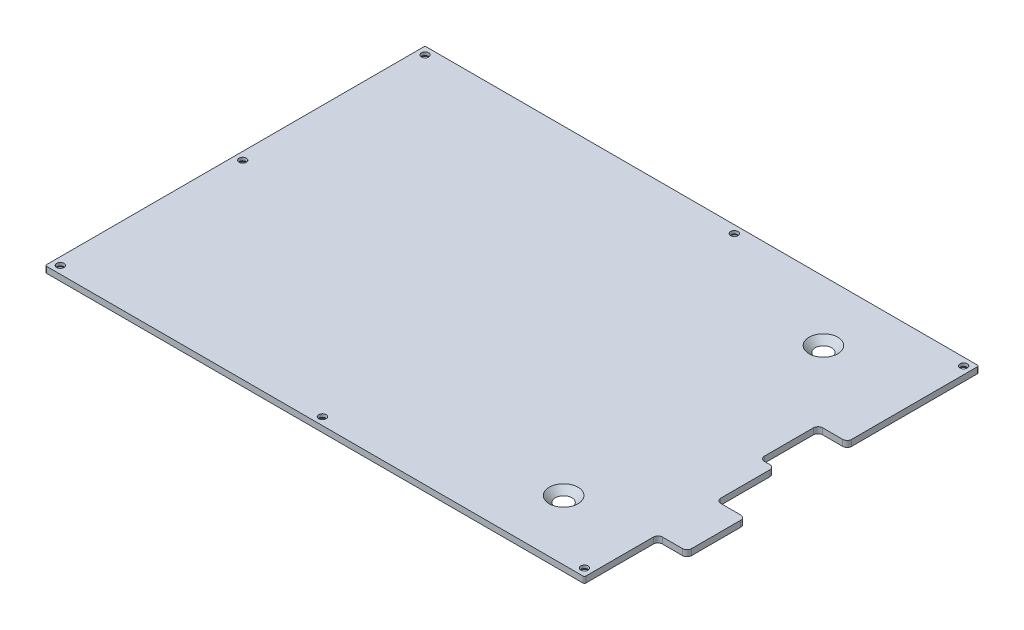
from build123d import *

# Parameters (mm, degrees)
PLATE_FRAME_DEPTH                              = 2
CSK_FOR_M2_FLAT_HEAD_MACHINE_SCREW2_AT_2_COUNT = 2
CSK_FOR_M2_FLAT_HEAD_MACHINE_SCREW2_AT_2_PITCH = 75
CSK_FOR_M2_FLAT_HEAD_MACHINE_SCREW2_AT_3_COUNT = 2
CSK_FOR_M2_FLAT_HEAD_MACHINE_SCREW2_AT_3_PITCH = 176.2125
CSK_FOR_M2_FLAT_HEAD_MACHINE_SCREW2_AT_4_COUNT = 2
CSK_FOR_M2_FLAT_HEAD_MACHINE_SCREW2_AT_4_PITCH = 186.034856025
CSK_FOR_M2_FLAT_HEAD_MACHINE_SCREW2_AT_5_COUNT = 2
CSK_FOR_M2_FLAT_HEAD_MACHINE_SCREW2_AT_5_PITCH = 212.798813804
CSK_FOR_M2_FLAT_HEAD_MACHINE_SCREW2_AT_6_COUNT = 2
CSK_FOR_M2_FLAT_HEAD_MACHINE_SCREW2_AT_6_PITCH = 149.734690891
CSK_FOR_M2_FLAT_HEAD_MACHINE_SCREW2_AT_7_COUNT = 2
CSK_FOR_M2_FLAT_HEAD_MACHINE_SCREW2_AT_7_PITCH = 119.395022535
CSK_FOR_M4_FLAT_HEAD_MACHINE_SCREW1_AT_2_COUNT = 2
CSK_FOR_M4_FLAT_HEAD_MACHINE_SCREW1_AT_2_PITCH = 85
FILLET3_R                                      = 1.5
FILLET4_R                                      = 0.5


with BuildPart() as part:
    # Sketch1 → Plate Frame (new body)
    with BuildSketch(Plane(origin=(0, 0, 0), x_dir=(1, 0, 0), z_dir=(0, 1, 0))):
        Polygon((0, 0), (0, 124.3), (181.2125, 124.3), (181.2125, 81.2), (171.6875, 81.2), (171.6875, 62.15), (176.45, 62.15), (176.45, 43.1), (185.975, 43.1), (185.975, 24.05), (176.45, 24.05), (176.45, 0), align=None)
    extrude(amount=PLATE_FRAME_DEPTH)

    # Sketch23 → CSK for M2 Flat Head Machine Screw2 (revolve, cut)
    with BuildSketch(Plane(origin=(178.7125, 0, -121.8), x_dir=(0, 0, -1), z_dir=(1, 0, 0))):
        Polygon((0, 0), (0, 2), (1.2, 2), (1.2, 1), (2.2, 0), align=None)
    csk_for_m2_flat_head_machine_screw2 = revolve(axis=Axis((178.7125, -6.35, -121.8), (0, 1, 0)), mode=Mode.SUBTRACT)

    # CSK for M2 Flat Head Machine Screw2 at 2: CSK for M2 Flat Head Machine Screw2 ×2
    with Locations(*[(-i * CSK_FOR_M2_FLAT_HEAD_MACHINE_SCREW2_AT_2_PITCH, 0, 0) for i in range(1, CSK_FOR_M2_FLAT_HEAD_MACHINE_SCREW2_AT_2_COUNT)]):
        add(csk_for_m2_flat_head_machine_screw2, mode=Mode.SUBTRACT)

    # CSK for M2 Flat Head Machine Screw2 at 3: CSK for M2 Flat Head Machine Screw2 ×2
    with Locations(*[(-i * CSK_FOR_M2_FLAT_HEAD_MACHINE_SCREW2_AT_3_PITCH, 0, 0) for i in range(1, CSK_FOR_M2_FLAT_HEAD_MACHINE_SCREW2_AT_3_COUNT)]):
        add(csk_for_m2_flat_head_machine_screw2, mode=Mode.SUBTRACT)

    # CSK for M2 Flat Head Machine Screw2 at 4: CSK for M2 Flat Head Machine Screw2 ×2
    with Locations(*[Vector(-0.9472015286011822, 0, 0.3206388376594201) * (i * CSK_FOR_M2_FLAT_HEAD_MACHINE_SCREW2_AT_4_PITCH) for i in range(1, CSK_FOR_M2_FLAT_HEAD_MACHINE_SCREW2_AT_4_COUNT)]):
        add(csk_for_m2_flat_head_machine_screw2, mode=Mode.SUBTRACT)

    # CSK for M2 Flat Head Machine Screw2 at 5: CSK for M2 Flat Head Machine Screw2 ×2
    with Locations(*[Vector(-0.828070875256726, 0, 0.5606234257962827) * (i * CSK_FOR_M2_FLAT_HEAD_MACHINE_SCREW2_AT_5_PITCH) for i in range(1, CSK_FOR_M2_FLAT_HEAD_MACHINE_SCREW2_AT_5_COUNT)]):
        add(csk_for_m2_flat_head_machine_screw2, mode=Mode.SUBTRACT)

    # CSK for M2 Flat Head Machine Screw2 at 6: CSK for M2 Flat Head Machine Screw2 ×2
    with Locations(*[Vector(-0.6043188753487793, 0, 0.7967425537130464) * (i * CSK_FOR_M2_FLAT_HEAD_MACHINE_SCREW2_AT_6_PITCH) for i in range(1, CSK_FOR_M2_FLAT_HEAD_MACHINE_SCREW2_AT_6_COUNT)]):
        add(csk_for_m2_flat_head_machine_screw2, mode=Mode.SUBTRACT)

    # CSK for M2 Flat Head Machine Screw2 at 7: CSK for M2 Flat Head Machine Screw2 ×2
    with Locations(*[Vector(-0.039888597521597645, 0, 0.9992041331918919) * (i * CSK_FOR_M2_FLAT_HEAD_MACHINE_SCREW2_AT_7_PITCH) for i in range(1, CSK_FOR_M2_FLAT_HEAD_MACHINE_SCREW2_AT_7_COUNT)]):
        add(csk_for_m2_flat_head_machine_screw2, mode=Mode.SUBTRACT)

    # Sketch26 → CSK for M4 Flat Head Machine Screw1 (revolve, cut)
    with BuildSketch(Plane(origin=(150, 2, -104.65), x_dir=(0, 0, 1), z_dir=(1, 0, 0))):
        Polygon((0, 0), (0, 2), (2.25, 2), (2.25, 2.45), (4.7, 0), align=None)
    csk_for_m4_flat_head_machine_screw1 = revolve(axis=Axis((150, 8.35, -104.65), (0, -1, 0)), mode=Mode.SUBTRACT)

    # CSK for M4 Flat Head Machine Screw1 at 2: CSK for M4 Flat Head Machine Screw1 ×2
    with Locations(*[(0, 0, i * CSK_FOR_M4_FLAT_HEAD_MACHINE_SCREW1_AT_2_PITCH) for i in range(1, CSK_FOR_M4_FLAT_HEAD_MACHINE_SCREW1_AT_2_COUNT)]):
        add(csk_for_m4_flat_head_machine_screw1, mode=Mode.SUBTRACT)

    # Fillet3
    fillet3_edges = [part.edges().sort_by_distance(p)[0] for p in [
        (181.2125, 1, -81.2),
        (171.6875, 1, -81.2),
        (171.6875, 1, -62.15),
        (176.45, 1, -62.15),
        (176.45, 1, -43.1),
        (185.975, 1, -43.1),
        (185.975, 1, -24.05),
        (176.45, 1, -24.05),
    ]]
    fillet(fillet3_edges, radius=FILLET3_R)

    # Fillet4
    fillet4_edges = [part.edges().sort_by_distance(p)[0] for p in [
        (0, 1, 0),
        (0, 1, -124.3),
        (181.2125, 1, -124.3),
        (176.45, 1, 0),
    ]]
    fillet(fillet4_edges, radius=FILLET4_R)


solid = part.part
